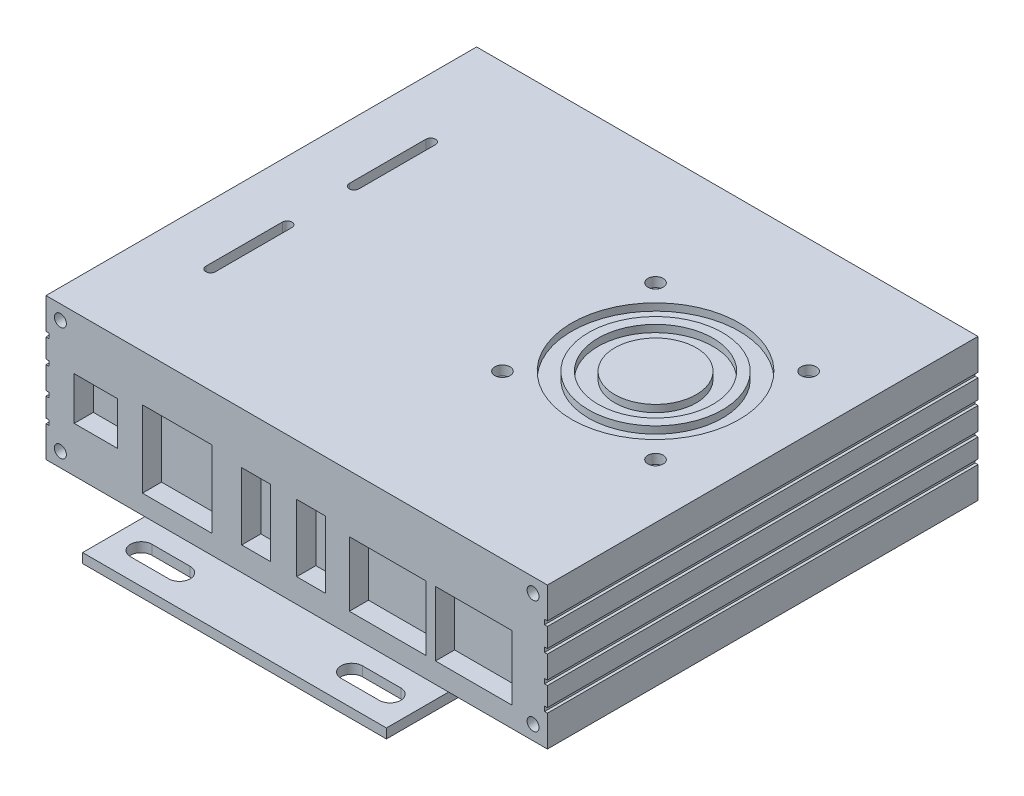
from build123d import *

# Parameters (mm, degrees)
SKETCH1_W           = 104.8
SKETCH1_H           = 90
BOSS_EXTRUDE1_DEPTH = 29.7
SKETCH2_W           = 63.5
SKETCH2_H           = 116
BOSS_EXTRUDE2_DEPTH = 2
CUT_EXTRUDE1_DEPTH  = 3
SKETCH4_R           = 1.25
SKETCH4_W           = 9
SKETCH4_H           = 9
SKETCH4_W_2         = 14.5
SKETCH4_H_2         = 16
SKETCH4_W_3         = 6
SKETCH4_H_3         = 14
SKETCH4_W_4         = 16
SKETCH4_H_4         = 13.5
CUT_EXTRUDE2_DEPTH  = 4
CUT_EXTRUDE4_START  = 2
SKETCH5_R           = 1.25
CUT_EXTRUDE4_DEPTH  = 2
SKETCH6_R           = 17.5
SKETCH6_R_2         = 14
CUT_EXTRUDE5_DEPTH  = 1.5
SKETCH7_R           = 12
SKETCH7_R_2         = 8.5
CUT_EXTRUDE6_DEPTH  = 1.5
SKETCH8_R           = 1.6
CUT_EXTRUDE7_DEPTH  = 2
SKETCH9_W           = 90
SKETCH9_H           = 1
CUT_EXTRUDE8_DEPTH  = 0.6
SKETCH10_W          = 90
SKETCH10_H          = 1
CUT_EXTRUDE10_DEPTH = 0.6


with BuildPart() as part:
    # Sketch1 → Boss-Extrude1 (new body)
    with BuildSketch(Plane(origin=(0, 0, 0), x_dir=(1, 0, 0), z_dir=(0, 1, 0))):
        Rectangle(SKETCH1_W, SKETCH1_H)
    extrude(amount=BOSS_EXTRUDE1_DEPTH)

    # Sketch2 → Boss-Extrude2 (add)
    with BuildSketch(Plane(origin=(0, 0, 0), x_dir=(1, 0, 0), z_dir=(0, 1, 0))):
        Rectangle(SKETCH2_W, SKETCH2_H)
    extrude(amount=-BOSS_EXTRUDE2_DEPTH)

    # Sketch3 → Cut-Extrude1 (cut)
    with BuildSketch(Plane.XZ.offset(2)):
        with BuildLine():
            Line((18, 53.75), (26, 53.75))
            ThreePointArc((26, 53.75), (28.25, 51.5), (26, 49.25))
            Line((26, 49.25), (18, 49.25))
            ThreePointArc((18, 49.25), (15.75, 51.5), (18, 53.75))
        make_face()
        with BuildLine():
            Line((-26, 53.75), (-18, 53.75))
            ThreePointArc((-18, 53.75), (-15.75, 51.5), (-18, 49.25))
            Line((-18, 49.25), (-26, 49.25))
            ThreePointArc((-26, 49.25), (-28.25, 51.5), (-26, 53.75))
        make_face()
        with BuildLine():
            Line((18, -49.25), (26, -49.25))
            ThreePointArc((26, -49.25), (28.25, -51.5), (26, -53.75))
            Line((26, -53.75), (18, -53.75))
            ThreePointArc((18, -53.75), (15.75, -51.5), (18, -49.25))
        make_face()
        with BuildLine():
            Line((-26, -49.25), (-18, -49.25))
            ThreePointArc((-18, -49.25), (-15.75, -51.5), (-18, -53.75))
            Line((-18, -53.75), (-26, -53.75))
            ThreePointArc((-26, -53.75), (-28.25, -51.5), (-26, -49.25))
        make_face()
    extrude(amount=-CUT_EXTRUDE1_DEPTH, mode=Mode.SUBTRACT)

    # Sketch4 → Cut-Extrude2 (cut)
    with BuildSketch(Plane.XY.offset(45)):
        with Locations((49.4, 3)):
            Circle(SKETCH4_R)
        with Locations((49.4, 26.7)):
            Circle(SKETCH4_R)
        with Locations((-49.4, 3)):
            Circle(SKETCH4_R)
        with Locations((-49.4, 26.7)):
            Circle(SKETCH4_R)
        with Locations((-42, 14)):
            Rectangle(SKETCH4_W, SKETCH4_H)
        with Locations((-25, 12)):
            Rectangle(SKETCH4_W_2, SKETCH4_H_2)
        with Locations((-8.5, 12)):
            Rectangle(SKETCH4_W_3, SKETCH4_H_3)
        with Locations((3, 12)):
            Rectangle(SKETCH4_W_3, SKETCH4_H_3)
        with Locations((19, 11)):
            Rectangle(SKETCH4_W_4, SKETCH4_H_4)
        with Locations((37, 11)):
            Rectangle(SKETCH4_W_4, SKETCH4_H_4)
    extrude(amount=-CUT_EXTRUDE2_DEPTH, mode=Mode.SUBTRACT)

    # Sketch5 → Cut-Extrude4 (cut)
    with BuildSketch(Plane.XY.offset(-45).offset(CUT_EXTRUDE4_START)):
        with Locations((49.4, 3)):
            Circle(SKETCH5_R)
        with Locations((49.4, 26.7)):
            Circle(SKETCH5_R)
        with Locations((-49.4, 3)):
            Circle(SKETCH5_R)
        with Locations((-49.4, 26.7)):
            Circle(SKETCH5_R)
    extrude(amount=-CUT_EXTRUDE4_DEPTH, mode=Mode.SUBTRACT)

    # Sketch6 → Cut-Extrude5 (cut)
    with BuildSketch(Plane(origin=(0, 29.7, 0), x_dir=(1, 0, 0), z_dir=(0, 1, 0))):
        with Locations(Location((25, 5, 0), (0, 0, 270))):
            Circle(SKETCH6_R)
        with Locations(Location((25, 5, 0), (0, 0, 270))):
            Circle(SKETCH6_R_2, mode=Mode.SUBTRACT)
    extrude(amount=-CUT_EXTRUDE5_DEPTH, mode=Mode.SUBTRACT)

    # Sketch7 → Cut-Extrude6 (cut)
    with BuildSketch(Plane(origin=(0, 29.7, 0), x_dir=(1, 0, 0), z_dir=(0, 1, 0))):
        with Locations(Location((25, 5, 0), (0, 0, 270))):
            Circle(SKETCH7_R)
        with Locations(Location((25, 5, 0), (0, 0, 270))):
            Circle(SKETCH7_R_2, mode=Mode.SUBTRACT)
    extrude(amount=-CUT_EXTRUDE6_DEPTH, mode=Mode.SUBTRACT)

    # Sketch8 → Cut-Extrude7 (cut)
    with BuildSketch(Plane(origin=(0, 29.7, 0), x_dir=(1, 0, 0), z_dir=(0, 1, 0))):
        with Locations(Location((41, -11, 0), (0, 0, 270))):
            Circle(SKETCH8_R)
        with Locations(Location((41, 21, 0), (0, 0, 270))):
            Circle(SKETCH8_R)
        with Locations(Location((9, -11, 0), (0, 0, 270))):
            Circle(SKETCH8_R)
        with Locations(Location((9, 21, 0), (0, 0, 270))):
            Circle(SKETCH8_R)
        with BuildLine():
            Line((-39, -7), (-39, -23))
            ThreePointArc((-39, -23), (-40, -24), (-41, -23))
            Line((-41, -23), (-41, -7))
            ThreePointArc((-41, -7), (-40, -6), (-39, -7))
        make_face()
        with BuildLine():
            Line((-39, 23), (-39, 7))
            ThreePointArc((-39, 7), (-40, 6), (-41, 7))
            Line((-41, 7), (-41, 23))
            ThreePointArc((-41, 23), (-40, 24), (-39, 23))
        make_face()
    extrude(amount=-CUT_EXTRUDE7_DEPTH, mode=Mode.SUBTRACT)

    # Sketch9 → Cut-Extrude8 (cut)
    with BuildSketch(Plane(origin=(52.4, 0, 0), x_dir=(0, 0, -1), z_dir=(1, 0, 0))):
        with Locations((0, 7)):
            Rectangle(SKETCH9_W, SKETCH9_H)
        with Locations((0, 12)):
            Rectangle(SKETCH9_W, SKETCH9_H)
        with Locations((0, 17.7)):
            Rectangle(SKETCH9_W, SKETCH9_H)
        with Locations((0, 22.7)):
            Rectangle(SKETCH9_W, SKETCH9_H)
    extrude(amount=-CUT_EXTRUDE8_DEPTH, mode=Mode.SUBTRACT)

    # Sketch10 → Cut-Extrude10 (cut)
    with BuildSketch(Plane(origin=(-52.4, 0, 0), x_dir=(0, 0, -1), z_dir=(1, 0, 0))):
        with Locations((0, 7)):
            Rectangle(SKETCH10_W, SKETCH10_H)
        with Locations((0, 12)):
            Rectangle(SKETCH10_W, SKETCH10_H)
        with Locations((0, 17.7)):
            Rectangle(SKETCH10_W, SKETCH10_H)
        with Locations((0, 22.7)):
            Rectangle(SKETCH10_W, SKETCH10_H)
    extrude(amount=CUT_EXTRUDE10_DEPTH, mode=Mode.SUBTRACT)


solid = part.part
